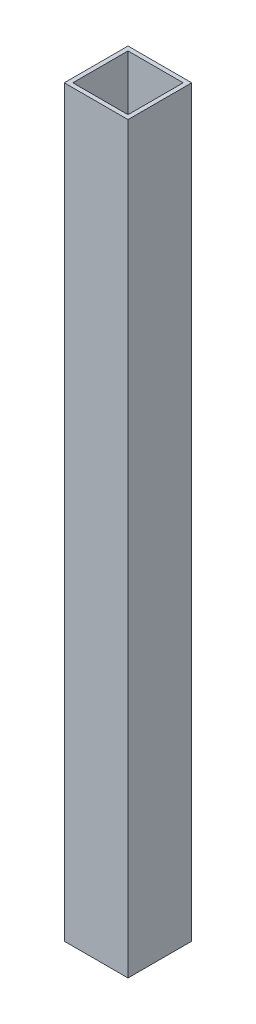
from build123d import *

# Parameters (mm, degrees)
SKETCH1_W           = 15
SKETCH1_H           = 15
SKETCH1_W_2         = 13
SKETCH1_H_2         = 13
BOSS_EXTRUDE1_DEPTH = 175


with BuildPart() as part:
    # Sketch1 → Boss-Extrude1 (new body)
    with BuildSketch(Plane(origin=(0, 0, 0), x_dir=(1, 0, 0), z_dir=(0, 1, 0))):
        Rectangle(SKETCH1_W, SKETCH1_H)
        Rectangle(SKETCH1_W_2, SKETCH1_H_2, mode=Mode.SUBTRACT)
    extrude(amount=BOSS_EXTRUDE1_DEPTH)


solid = part.part
